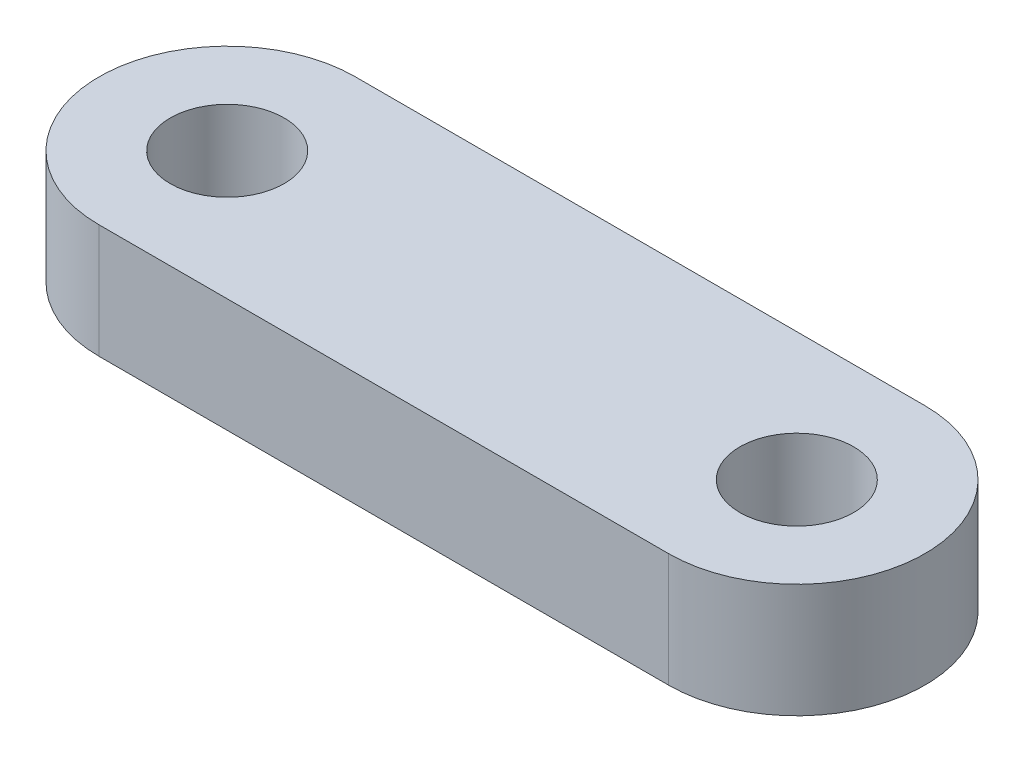
from build123d import *

# Parameters (mm, degrees)
SKETCH_1_R      = 2
EXTRUDE_1_DEPTH = 4


with BuildPart() as part:
    # Эскиз1 → Вытянуть1 (new body)
    with BuildSketch(Plane(origin=(0, 0, 0), x_dir=(1, 0, 0), z_dir=(0, 1, 0))):
        with BuildLine():
            Line((0, 4.5), (20, 4.5))
            ThreePointArc((20, 4.5), (24.5, 0), (20, -4.5))
            Line((20, -4.5), (0, -4.5))
            ThreePointArc((0, -4.5), (-4.5, 0), (0, 4.5))
        make_face()
        with Locations(Location((0, 0, 0), (0, 0, 270))):
            Circle(SKETCH_1_R, mode=Mode.SUBTRACT)
        with Locations(Location((20, 0, 0), (0, 0, 270))):
            Circle(SKETCH_1_R, mode=Mode.SUBTRACT)
    extrude(amount=EXTRUDE_1_DEPTH)


solid = part.part
